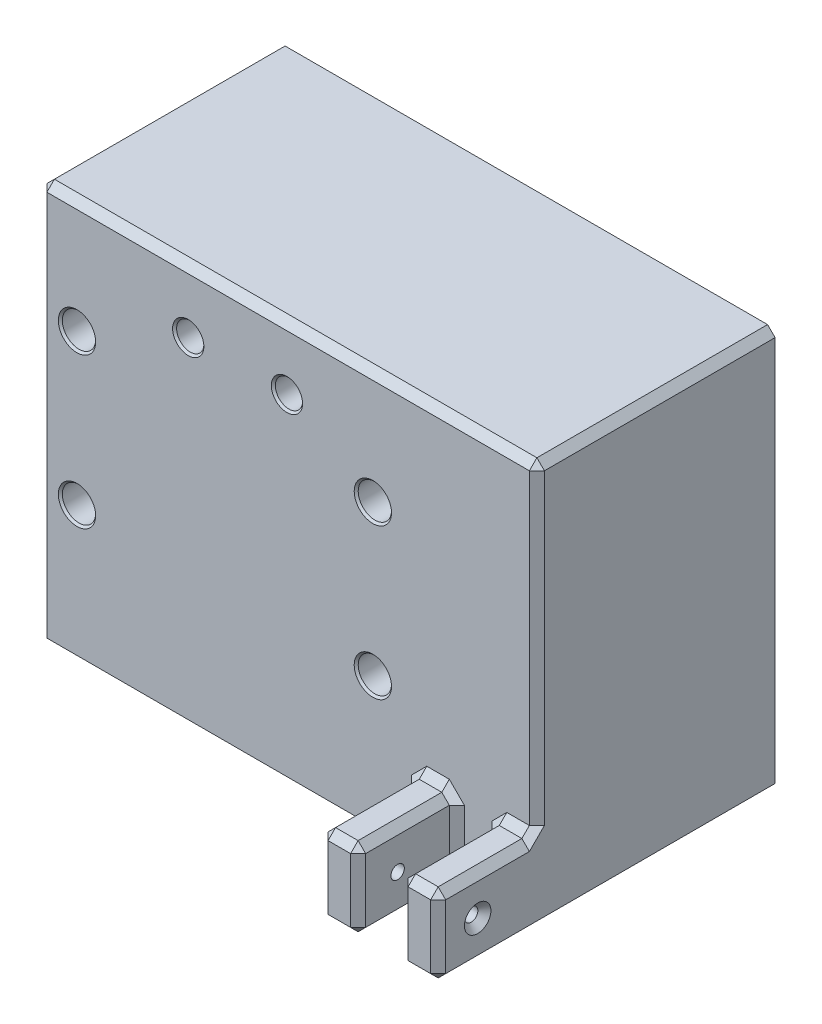
from build123d import *

# Parameters (mm, degrees)
SKETCH1_W                                       = 125.999061968
SKETCH1_H                                       = 101.6
SKETCH1_R                                       = 1.27
SKETCH1_R_2                                     = 3.45
BOSS_EXTRUDE1_DEPTH                             = 60.325
SKETCH1_3_W                                     = 9.525
SKETCH1_3_H                                     = 20
BOSS_EXTRUDE2_DEPTH                             = 25
CUT_EXTRUDE1_DEPTH                              = 149.645582651
CUT_EXTRUDE1_DEPTH_BACK                         = 149.645582651
SKETCH2_R                                       = 1.5999968
CSK_FOR_8_FLAT_HEAD_MACHINE_SCREW_2_COUNT       = 2
CSK_FOR_8_FLAT_HEAD_MACHINE_SCREW_2_PITCH       = 38.1
CSK_FOR_8_FLAT_HEAD_MACHINE_SCREW_3_COUNT       = 2
CSK_FOR_8_FLAT_HEAD_MACHINE_SCREW_3_PITCH       = 84.060186176
CSK_FOR_8_FLAT_HEAD_MACHINE_SCREW_4_COUNT       = 2
CSK_FOR_8_FLAT_HEAD_MACHINE_SCREW_4_PITCH       = 74.93
CSK_FOR_M3_FLAT_HEAD_MACHINE_SCREW1_D           = 3.4
CSK_FOR_M3_FLAT_HEAD_MACHINE_SCREW1_CSINK_D     = 6.7
CSK_FOR_M3_FLAT_HEAD_MACHINE_SCREW1_CSINK_ANGLE = 90
CHAMFER1_SIZE                                   = 0.508
CHAMFER2_SIZE                                   = 1.905


with BuildPart() as part:
    # Sketch1 → Boss-Extrude1 (new body)
    with BuildSketch(Plane.XY):
        Rectangle(SKETCH1_W, SKETCH1_H)
        with Locations((-53.474530984, -15.875)):
            Circle(SKETCH1_R, mode=Mode.SUBTRACT)
        with Locations((21.455469016, -15.875)):
            Circle(SKETCH1_R, mode=Mode.SUBTRACT)
        with Locations((-53.474530984, 22.225)):
            Circle(SKETCH1_R, mode=Mode.SUBTRACT)
        with Locations((-25.299530984, 34.925)):
            Circle(SKETCH1_R_2, mode=Mode.SUBTRACT)
        with Locations((-0.299530984, 34.925)):
            Circle(SKETCH1_R_2, mode=Mode.SUBTRACT)
        with Locations((21.455469016, 22.225)):
            Circle(SKETCH1_R, mode=Mode.SUBTRACT)
    extrude(amount=-BOSS_EXTRUDE1_DEPTH)

    # Sketch1<3> → Boss-Extrude2 (add)
    with BuildSketch(Plane.XY):
        with Locations((58.237030984, -40.8)):
            Rectangle(SKETCH1_3_W, SKETCH1_3_H)
        with Locations((37.962030984, -40.8)):
            Rectangle(SKETCH1_3_W, SKETCH1_3_H)
    extrude(amount=BOSS_EXTRUDE2_DEPTH)

    # Sketch2 → Cut-Extrude1 (cut, two sides: drawn at the far end of the back side and taken through both)
    with BuildSketch(Plane(origin=(62.999530984, 0, 0), x_dir=(0, 0, -1), z_dir=(1, 0, 0)).offset(-CUT_EXTRUDE1_DEPTH_BACK)):
        with Locations((-15, -40.8)):
            Circle(SKETCH2_R)
    extrude(amount=CUT_EXTRUDE1_DEPTH + CUT_EXTRUDE1_DEPTH_BACK, mode=Mode.SUBTRACT)

    # Sketch6 → CSK for #8 Flat Head Machine Screw (100)1 (revolve, cut)
    with BuildSketch(Plane(origin=(-53.474530984, 22.225, 0), x_dir=(0, -1, 0), z_dir=(1, 0, 0))):
        Polygon((0, 0), (0, 60.325), (2.2479, 60.325), (2.2479, 39.751763788), (4.216395428, 38.1), (4.216395428, 0), align=None)
    csk_for_8_flat_head_machine_screw_100 = revolve(axis=Axis((-53.474530984, 22.225, 6.35), (0, 0, -1)), mode=Mode.SUBTRACT)

    # CSK for _8 Flat Head Machine Screw _ 2: CSK for #8 Flat Head Machine Screw (100)1 ×2
    with Locations(*[(0, -i * CSK_FOR_8_FLAT_HEAD_MACHINE_SCREW_2_PITCH, 0) for i in range(1, CSK_FOR_8_FLAT_HEAD_MACHINE_SCREW_2_COUNT)]):
        add(csk_for_8_flat_head_machine_screw_100, mode=Mode.SUBTRACT)

    # CSK for _8 Flat Head Machine Screw _ 3: CSK for #8 Flat Head Machine Screw (100)1 ×2
    with Locations(*[Vector(0.8913851302068038, -0.453246676376341, 0) * (i * CSK_FOR_8_FLAT_HEAD_MACHINE_SCREW_3_PITCH) for i in range(1, CSK_FOR_8_FLAT_HEAD_MACHINE_SCREW_3_COUNT)]):
        add(csk_for_8_flat_head_machine_screw_100, mode=Mode.SUBTRACT)

    # CSK for _8 Flat Head Machine Screw _ 4: CSK for #8 Flat Head Machine Screw (100)1 ×2
    with Locations(*[(i * CSK_FOR_8_FLAT_HEAD_MACHINE_SCREW_4_PITCH, 0, 0) for i in range(1, CSK_FOR_8_FLAT_HEAD_MACHINE_SCREW_4_COUNT)]):
        add(csk_for_8_flat_head_machine_screw_100, mode=Mode.SUBTRACT)

    # CSK for M3 Flat Head Machine Screw1 (through all)
    with Locations(Plane(origin=(62.999530984, 0, 0), x_dir=(0, 0, -1), z_dir=(1, 0, 0))):
        with Locations((-15, -40.8)):
            CounterSinkHole(CSK_FOR_M3_FLAT_HEAD_MACHINE_SCREW1_D / 2, CSK_FOR_M3_FLAT_HEAD_MACHINE_SCREW1_CSINK_D / 2, counter_sink_angle=CSK_FOR_M3_FLAT_HEAD_MACHINE_SCREW1_CSINK_ANGLE)

    # Chamfer1
    chamfer1_edges = [part.edges().sort_by_distance(p)[0] for p in [
        (-3.749530984, 34.925, 0),
        (-28.749530984, 34.925, 0),
        (21.455469016, -11.658604572, 0),
        (-53.474530984, 26.441395428, 0),
        (-53.474530984, -11.658604572, 0),
        (21.455469016, 26.441395428, 0),
    ]]
    chamfer(chamfer1_edges, length=CHAMFER1_SIZE)

    # Chamfer2
    chamfer2_edges = [part.edges().sort_by_distance(p)[0] for p in [
        (53.474530984, -50.8, 12.5),
        (42.724530984, -50.8, 12.5),
        (48.099530984, -50.8, 0),
        (53.474530984, -40.8, 0),
        (42.724530984, -40.8, 0),
        (33.199530984, -50.8, 12.5),
        (62.999530984, -30.8, 12.5),
        (58.237030984, -30.8, 25),
        (62.999530984, -40.8, 25),
        (62.999530984, -50.8, -17.6625),
        (58.237030984, -50.8, 25),
        (53.474530984, -40.8, 25),
        (53.474530984, -30.8, 12.5),
        (58.237030984, -30.8, 0),
        (42.724530984, -30.8, 12.5),
        (37.962030984, -30.8, 25),
        (42.724530984, -40.8, 25),
        (37.962030984, -50.8, 25),
        (33.199530984, -40.8, 25),
        (33.199530984, -30.8, 12.5),
        (37.962030984, -30.8, 0),
        (-62.999530984, 50.8, -30.1625),
        (-62.999530984, -50.8, -30.1625),
        (62.999530984, 50.8, -30.1625),
        (33.199530984, -40.8, 0),
        (62.999530984, 10, 0),
        (-14.9, -50.8, 0),
        (-62.999530984, 0, 0),
        (0, 50.8, 0),
    ]]
    chamfer(chamfer2_edges, length=CHAMFER2_SIZE)


solid = part.part
